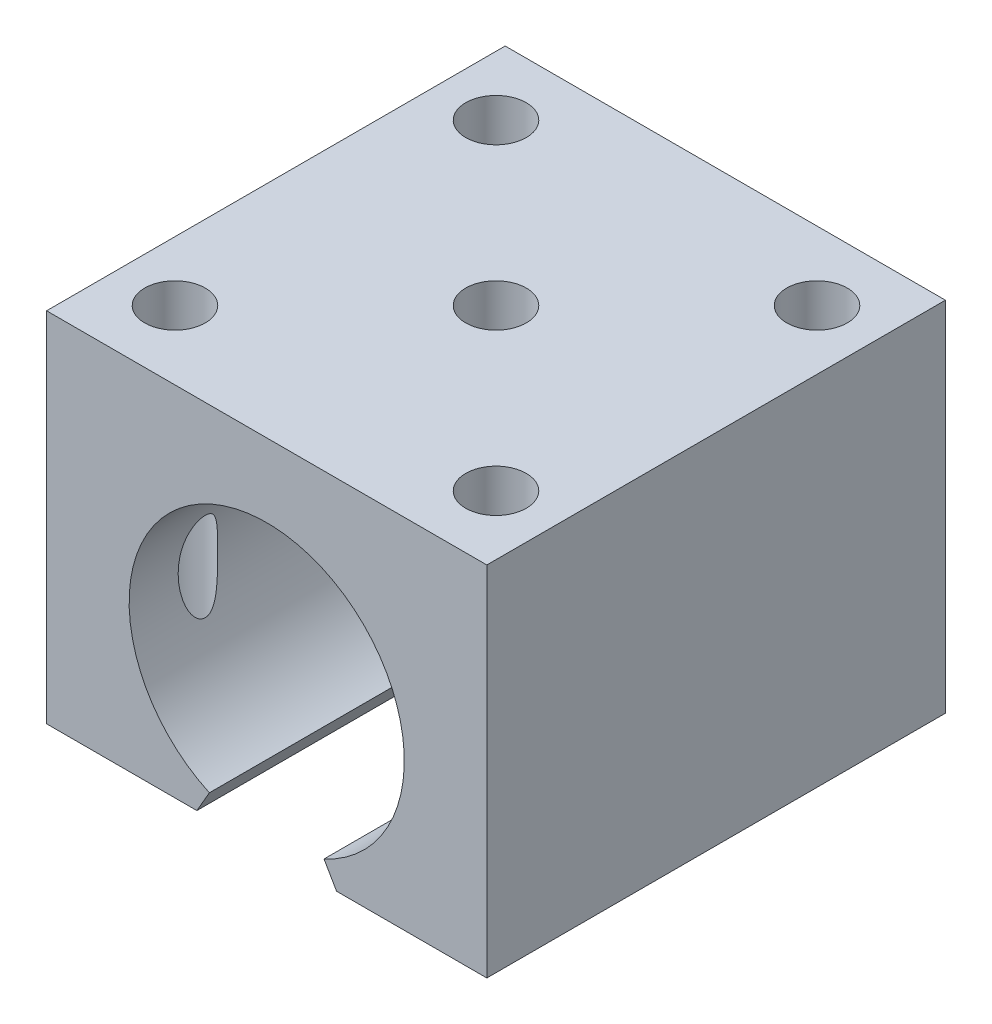
from build123d import *

# Parameters (mm, degrees)
SKETCH1_W            = 48
SKETCH1_H            = 50
BOSS_EXTRUDE1_DEPTH  = 39
M6_CLEARANCE_HOLE1_D = 6.6
CUT_EXTRUDE1_DEPTH   = 80.529868603


with BuildPart() as part:
    # Sketch1 → Boss-Extrude1 (new body)
    with BuildSketch(Plane(origin=(0, 0, 0), x_dir=(1, 0, 0), z_dir=(0, 1, 0))):
        with Locations((24, 25)):
            Rectangle(SKETCH1_W, SKETCH1_H)
    extrude(amount=BOSS_EXTRUDE1_DEPTH)

    # M6 Clearance Hole1 (through all)
    with Locations(Plane(origin=(0, 39, 0), x_dir=(1, 0, 0), z_dir=(0, 1, 0))):
        with Locations((6.5, 42.5), (41.5, 42.5), (41.5, 7.5), (6.5, 7.5), (24, 25)):
            Hole(M6_CLEARANCE_HOLE1_D / 2)

    # Sketch4 → Cut-Extrude1 (cut, through all)
    with BuildSketch(Plane.XY):
        with BuildLine():
            Line((30.25, 2.364109857), (31.614919462, 0))
            Line((31.614919462, 0), (16.385080538, 0))
            Line((16.385080538, 0), (17.75, 2.364109857))
            ThreePointArc((17.75, 2.364109857), (24, 31), (30.25, 2.364109857))
        make_face()
    extrude(amount=-CUT_EXTRUDE1_DEPTH, mode=Mode.SUBTRACT)


solid = part.part
